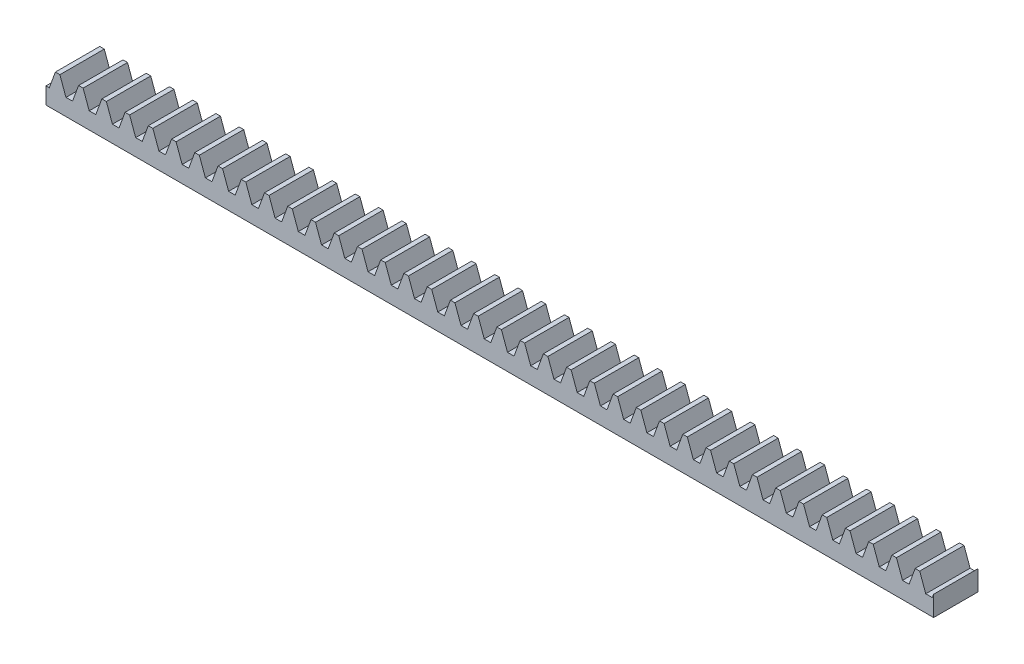
from build123d import *

# Parameters (mm, degrees)
BLANKSKE_W        = 120
BLANKSKE_H        = 4.5
BLANK_DEPTH       = 6
TOOTHCUTSIM_DEPTH = 121.234146564
TEETHCUTS_COUNT   = 39
TEETHCUTS_PITCH   = 3.14159265


with BuildPart() as part:
    # BlankSke → Blank (new body)
    with BuildSketch(Plane.XY):
        with Locations((60, 2.25)):
            Rectangle(BLANKSKE_W, BLANKSKE_H)
    extrude(amount=-BLANK_DEPTH)

    # TooCutSkeSim → ToothCutSim (cut, through all)
    with BuildSketch(Plane.XY):
        Polygon((0.44443537, 2.25), (-0.44443537, 2.25), (-1.272613241, 4.5254), (1.272613241, 4.5254), align=None)
    toothcutsim = extrude(amount=-TOOTHCUTSIM_DEPTH, mode=Mode.SUBTRACT)

    # TeethCuts: ToothCutSim ×39
    with Locations(*[(i * TEETHCUTS_PITCH, 0, 0) for i in range(1, TEETHCUTS_COUNT)]):
        add(toothcutsim, mode=Mode.SUBTRACT)


solid = part.part
